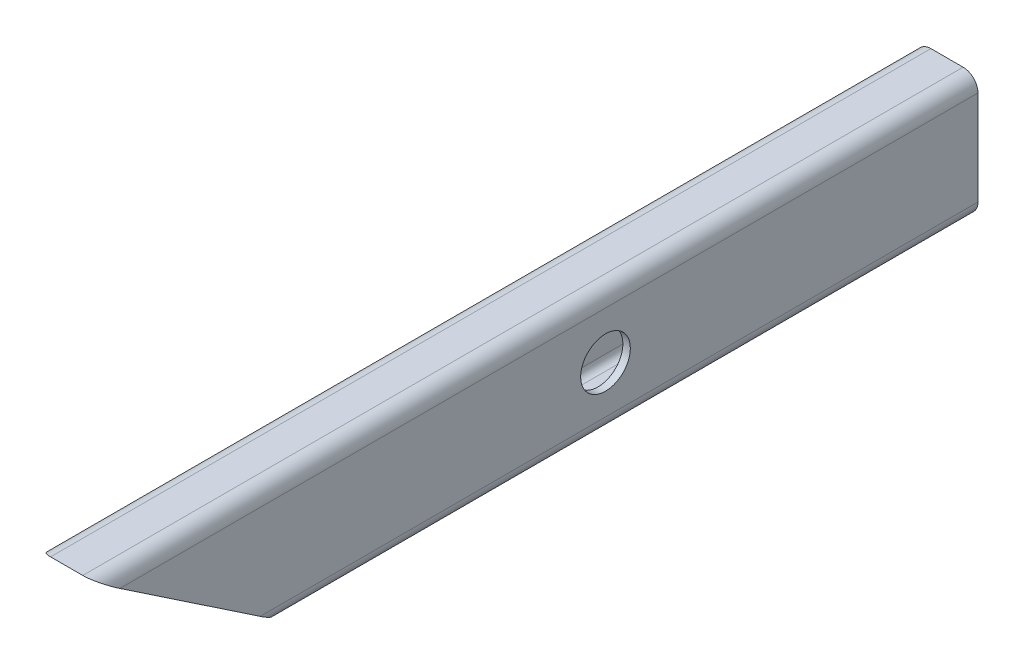
from build123d import *

# Parameters (mm, degrees)
BOSS_EXTRUDE1_DEPTH = 356.5
CUT_EXTRUDE1_DEPTH  = 361.853587106
SKETCH3_R           = 10
CUT_EXTRUDE2_DEPTH  = 359.877850149


with BuildPart() as part:
    # Sketch1 → Boss-Extrude1 (new body)
    with BuildSketch(Plane.XY):
        with BuildLine():
            Line((0, 44), (0, 6))
            ThreePointArc((0, 6), (1.757359313, 1.757359313), (6, 0))
            Line((6, 0), (18.96119643, 0))
            ThreePointArc((18.96119643, 0), (23.203837117, 1.757359313), (24.96119643, 6))
            Line((24.96119643, 6), (24.96119643, 44))
            ThreePointArc((24.96119643, 44), (23.203837117, 48.242640687), (18.96119643, 50))
            Line((18.96119643, 50), (6, 50))
            ThreePointArc((6, 50), (1.757359313, 48.242640687), (0, 44))
        make_face()
        with BuildLine():
            Line((3, 44), (3, 6))
            ThreePointArc((3, 6), (3.878679656, 3.878679656), (6, 3))
            Line((6, 3), (18.96119643, 3))
            ThreePointArc((18.96119643, 3), (21.082516774, 3.878679656), (21.96119643, 6))
            Line((21.96119643, 6), (21.96119643, 44))
            ThreePointArc((21.96119643, 44), (21.082516774, 46.121320344), (18.96119643, 47))
            Line((18.96119643, 47), (6, 47))
            ThreePointArc((6, 47), (3.878679656, 46.121320344), (3, 44))
        make_face(mode=Mode.SUBTRACT)
    extrude(amount=BOSS_EXTRUDE1_DEPTH)

    # Sketch2 → Cut-Extrude1 (cut, through all)
    with BuildSketch(Plane(origin=(24.96119643, 0, 0), x_dir=(0, 0, -1), z_dir=(1, 0, 0))):
        Polygon((-354.5, 50), (-356.5, 50), (-356.5, 0), (-291.6, 0), (-280.114542558, 0), align=None)
    extrude(amount=-CUT_EXTRUDE1_DEPTH, mode=Mode.SUBTRACT)

    # Sketch3 → Cut-Extrude2 (cut, through all)
    with BuildSketch(Plane(origin=(24.96119643, 0, 0), x_dir=(0, 0, -1), z_dir=(1, 0, 0))):
        with Locations(Location((-150, 25, 0), (0, 0, 90))):
            Circle(SKETCH3_R)
    extrude(amount=-CUT_EXTRUDE2_DEPTH, mode=Mode.SUBTRACT)


solid = part.part
